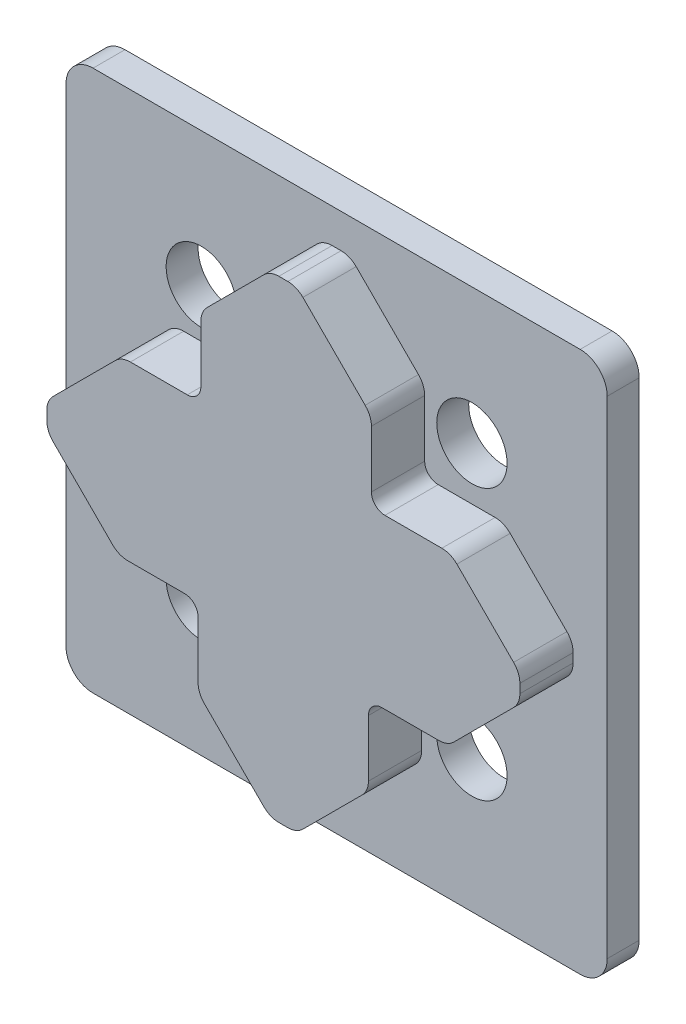
from build123d import *

# Parameters (mm, degrees)
SKETCH1_W           = 50.8
SKETCH1_H           = 50.8
BOSS_EXTRUDE1_DEPTH = 3
BOSS_EXTRUDE2_DEPTH = 5
FILLET1_R           = 2
SKETCH3_R           = 3.302
CUT_EXTRUDE3_DEPTH  = 75.162524229
FILLET2_R           = 2.54


with BuildPart() as part:
    # Sketch1 → Boss-Extrude1 (new body)
    with BuildSketch(Plane.XY):
        with Locations((25.4, 25.4)):
            Rectangle(SKETCH1_W, SKETCH1_H)
    extrude(amount=BOSS_EXTRUDE1_DEPTH)

    # Sketch8 → Boss-Extrude2 (add)
    with BuildSketch(Plane(origin=(3, 0, 3), x_dir=(1, 0, 0), z_dir=(0, 0, 1))):
        with BuildLine():
            Line((14.4, 9.95), (14.4, 16.117488447))
            ThreePointArc((14.4, 16.117488447), (14.028025612, 17.015514059), (13.13, 17.387488447))
            Line((13.13, 17.387488447), (6.962511553, 17.387488447))
            Line((6.962511553, 17.387488447), (0.2, 24.15))
            Line((0.2, 24.15), (0.2, 26.65))
            Line((0.2, 26.65), (7.217411382, 33.667411382))
            Line((7.217411382, 33.667411382), (13.384899829, 33.667411382))
            ThreePointArc((13.384899829, 33.667411382), (14.282925441, 34.03938577), (14.654899829, 34.937411382))
            Line((14.654899829, 34.937411382), (14.654899829, 41.104899829))
            Line((14.654899829, 41.104899829), (21.15, 47.6))
            Line((21.15, 47.6), (23.65, 47.6))
            Line((23.65, 47.6), (30.667411382, 40.582588618))
            Line((30.667411382, 40.582588618), (30.667411382, 34.415100171))
            ThreePointArc((30.667411382, 34.415100171), (31.03938577, 33.517074559), (31.937411382, 33.145100171))
            Line((31.937411382, 33.145100171), (38.104899829, 33.145100171))
            Line((38.104899829, 33.145100171), (44.6, 26.65))
            Line((44.6, 26.65), (44.6, 24.15))
            Line((44.6, 24.15), (37.824884254, 17.374884254))
            Line((37.824884254, 17.374884254), (31.657395807, 17.374884254))
            ThreePointArc((31.657395807, 17.374884254), (30.759370195, 17.002909866), (30.387395807, 16.104884254))
            Line((30.387395807, 16.104884254), (30.387395807, 9.937395807))
            Line((30.387395807, 9.937395807), (23.65, 3.2))
            Line((23.65, 3.2), (21.15, 3.2))
            Line((21.15, 3.2), (14.4, 9.95))
        make_face()
    extrude(amount=BOSS_EXTRUDE2_DEPTH)

    # Fillet1
    fillet1_edges = [part.edges().sort_by_distance(p)[0] for p in [
        (26.65, 3.2, 5.5),
        (24.15, 3.2, 5.5),
        (40.824884254, 17.374884254, 5.5),
        (47.6, 24.15, 5.5),
        (47.6, 26.65, 5.5),
        (41.104899829, 33.145100171, 5.5),
        (33.667411382, 40.582588618, 5.5),
        (26.65, 47.6, 5.5),
        (24.15, 47.6, 5.5),
        (17.654899829, 41.104899829, 5.5),
        (10.217411382, 33.667411382, 5.5),
        (3.2, 26.65, 5.5),
        (3.2, 24.15, 5.5),
        (9.962511553, 17.387488447, 5.5),
        (33.387395807, 9.937395807, 5.5),
        (17.4, 9.95, 5.5),
    ]]
    fillet(fillet1_edges, radius=FILLET1_R)

    # Sketch3 → Cut-Extrude3 (cut, through all)
    with BuildSketch(Plane(origin=(-3, 0, 3), x_dir=(-1, 0, 0), z_dir=(0, 0, -1))):
        with Locations((-15.7, 12.7)):
            Circle(SKETCH3_R)
        with Locations((-41.1, 38.1)):
            Circle(SKETCH3_R)
        with Locations((-15.7, 38.1)):
            Circle(SKETCH3_R)
        with Locations((-41.1, 12.7)):
            Circle(SKETCH3_R)
    extrude(amount=CUT_EXTRUDE3_DEPTH, mode=Mode.SUBTRACT)

    # Fillet2
    fillet2_edges = [part.edges().sort_by_distance(p)[0] for p in [
        (0, 0, 1.5),
        (50.8, 0, 1.5),
        (50.8, 50.8, 1.5),
        (0, 50.8, 1.5),
    ]]
    fillet(fillet2_edges, radius=FILLET2_R)


solid = part.part
